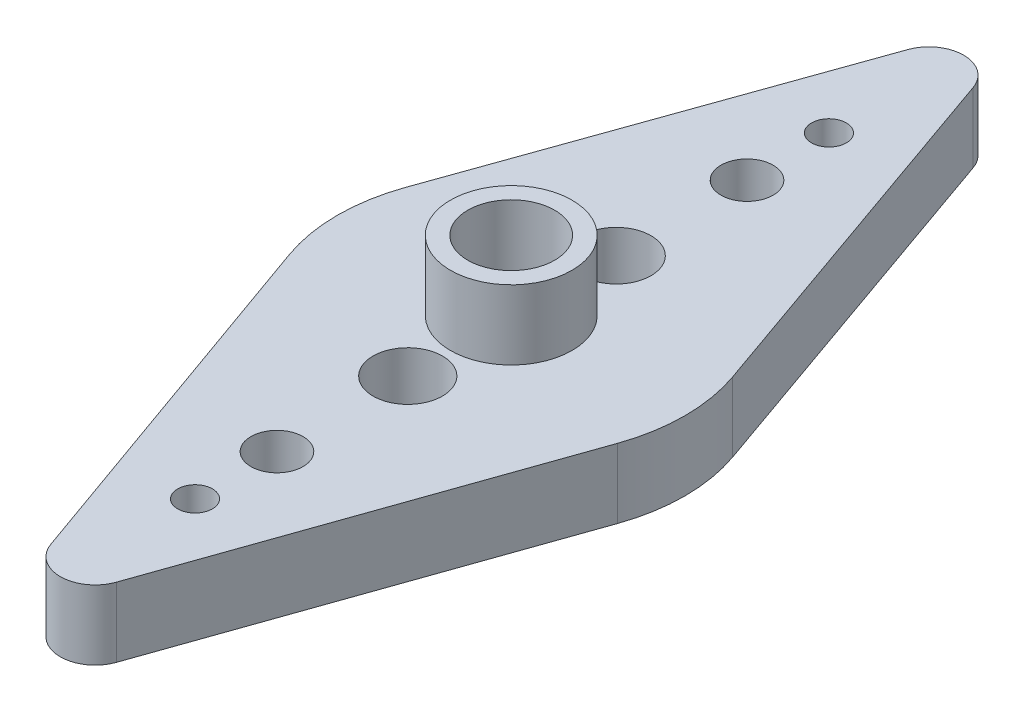
from build123d import *

# Parameters (mm, degrees)
SKETCH1_R           = 0.5
SKETCH1_R_2         = 0.75
SKETCH1_R_3         = 1
BOSS_EXTRUDE1_DEPTH = 2
SKETCH2_R           = 1.75
SKETCH2_R_2         = 1.25
EXTRUDE_THIN1_DEPTH = 2


with BuildPart() as part:
    # Sketch1 → Boss-Extrude1 (new body)
    with BuildSketch(Plane(origin=(0, 0, 0), x_dir=(1, 0, 0), z_dir=(0, 1, 0))):
        with BuildLine():
            Line((-4.710957819, 1.675373519), (-0.920020296, 12.335054222))
            ThreePointArc((-0.920020296, 12.335054222), (0.024018874, 12.999977811), (0.965594569, 12.331570343))
            Line((0.965594569, 12.331570343), (4.717116505, 1.657954125))
            ThreePointArc((4.717116505, 1.657954125), (5, 0), (4.717116505, -1.657954125))
            Line((4.717116505, -1.657954125), (0.965594569, -12.331570343))
            ThreePointArc((0.965594569, -12.331570343), (0.024018874, -12.999977811), (-0.920020296, -12.335054222))
            Line((-0.920020296, -12.335054222), (-4.710957819, -1.675373519))
            ThreePointArc((-4.710957819, -1.675373519), (-5, 0), (-4.710957819, 1.675373519))
        make_face()
        with Locations(Location((0.022171268, 9.122391825, 0), (0, 0, 270))):
            Circle(SKETCH1_R, mode=Mode.SUBTRACT)
        with Locations(Location((0.022171268, 6.764981493, 0), (0, 0, 270))):
            Circle(SKETCH1_R_2, mode=Mode.SUBTRACT)
        with Locations(Location((0.022171268, 3.000162006, 0), (0, 0, 270))):
            Circle(SKETCH1_R_3, mode=Mode.SUBTRACT)
        with Locations(Location((0.022171268, -9.122391825, 0), (0, 0, 90))):
            Circle(SKETCH1_R, mode=Mode.SUBTRACT)
        with Locations(Location((0.022171268, -6.764981493, 0), (0, 0, 90))):
            Circle(SKETCH1_R_2, mode=Mode.SUBTRACT)
        with Locations(Location((0.022171268, -3.000162006, 0), (0, 0, 90))):
            Circle(SKETCH1_R_3, mode=Mode.SUBTRACT)
    extrude(amount=BOSS_EXTRUDE1_DEPTH)

    # Sketch2 → Extrude-Thin1 (add)
    with BuildSketch(Plane(origin=(0, 2, 0), x_dir=(1, 0, 0), z_dir=(0, 1, 0))):
        Circle(SKETCH2_R)
        Circle(SKETCH2_R_2, mode=Mode.SUBTRACT)
    extrude(amount=EXTRUDE_THIN1_DEPTH)


solid = part.part
